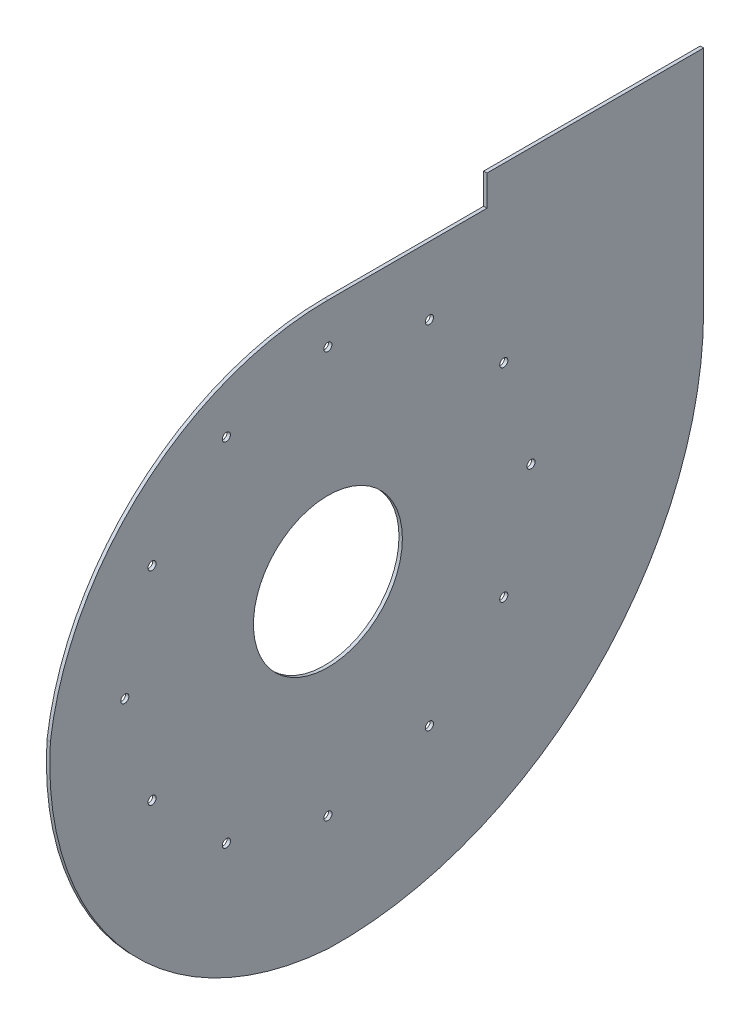
from build123d import *

# Parameters (mm, degrees)
SKETCH1_R           = 110
BOSS_EXTRUDE1_DEPTH = 5
SKETCH2_R           = 6
CUT_EXTRUDE1_DEPTH  = 10
CIRPATTERN1_COUNT   = 12


with BuildPart() as part:
    # Sketch1 → Boss-Extrude1 (new body)
    with BuildSketch(Plane(origin=(0, 0, 0), x_dir=(0, 0, -1), z_dir=(1, 0, 0))):
        with BuildLine():
            Line((-126.985698369, 168.770507744), (193.014301631, 168.770507744))
            Line((193.014301631, 168.770507744), (193.014301631, -166.625210225))
            ThreePointArc((193.014301631, -166.625210225), (29.499330124, -553.664543235), (-361.985698369, -706.229492256))
            ThreePointArc((-361.985698369, -706.229492256), (-663.674001264, -555.574607548), (-771.985698369, -236.229492256))
            ThreePointArc((-771.985698369, -236.229492256), (-634.689640971, 20.877775707), (-361.985698369, 123.770507744))
            Line((-361.985698369, 123.770507744), (-126.985698369, 123.770507744))
            Line((-126.985698369, 123.770507744), (-126.985698369, 168.770507744))
        make_face()
        with Locations((-361.985698369, -236.229492256)):
            Circle(SKETCH1_R, mode=Mode.SUBTRACT)
    extrude(amount=BOSS_EXTRUDE1_DEPTH)

    # Sketch2 → Cut-Extrude1 (cut)
    with BuildSketch(Plane.ZY):
        with Locations((661.985698369, -236.229492256)):
            Circle(SKETCH2_R)
    cut_extrude1 = extrude(amount=-CUT_EXTRUDE1_DEPTH, mode=Mode.SUBTRACT)

    # CirPattern1: Cut-Extrude1 ×12 about axis
    cirpattern1_axis = Axis((0, -236.229492256, 361.985698369), (1, 0, 0))
    for i in range(1, CIRPATTERN1_COUNT):
        add(cut_extrude1.rotate(cirpattern1_axis, i * 360 / CIRPATTERN1_COUNT), mode=Mode.SUBTRACT)


solid = part.part
